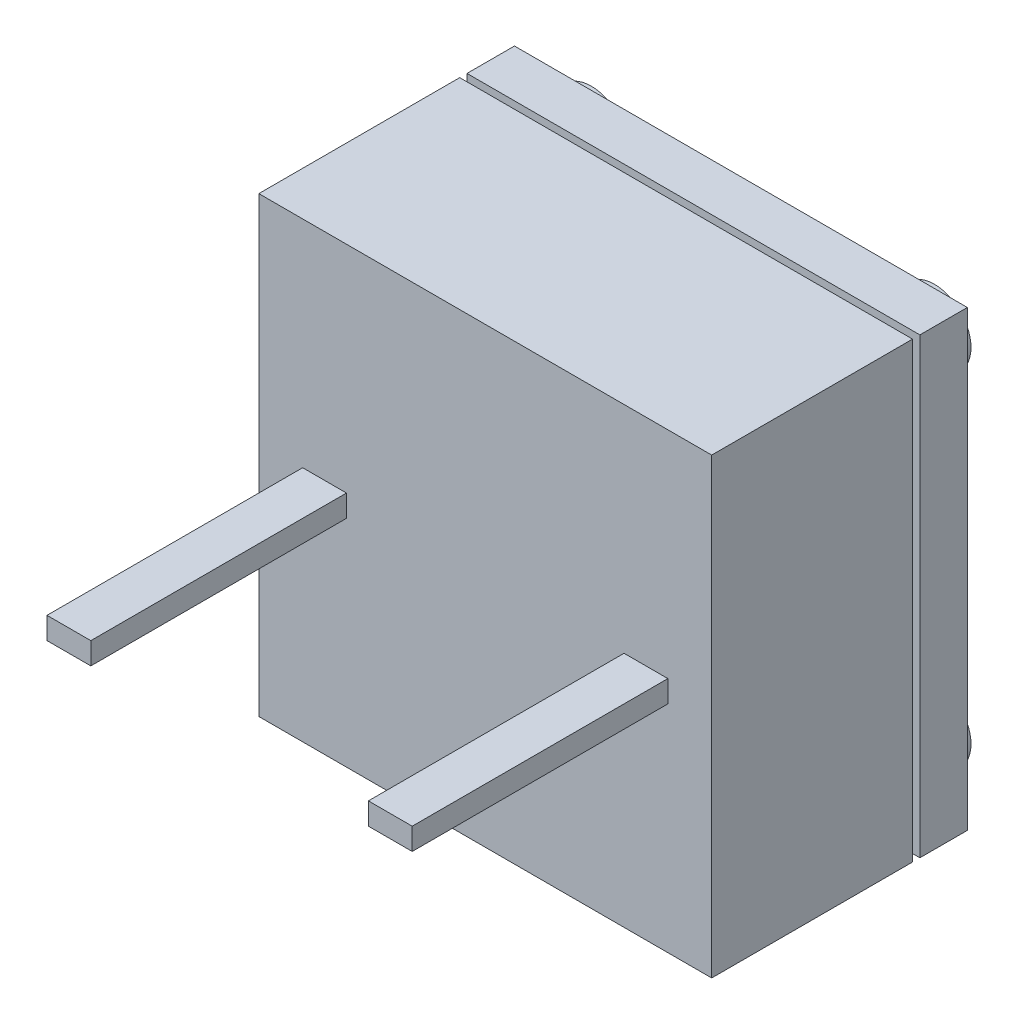
from build123d import *

# Parameters (mm, degrees)
CROQUIS1_W                 = 6.2
CROQUIS1_H                 = 6.2
SALIENTE_EXTRUIR1_DEPTH    = 3.5
CROQUIS2_W                 = 6.2
CROQUIS2_H                 = 0.1
CORTAR_EXTRUIR1_DEPTH      = 0.1
CORTAR_EXTRUIR2_DEPTH      = 10.375499987
CORTAR_EXTRUIR2_DEPTH_BACK = 10.375499987
CROQUIS3_W                 = 0.1
CROQUIS3_H                 = 0.1
CORTAR_EXTRUIR3_DEPTH      = 10.375499987
CORTAR_EXTRUIR3_DEPTH_BACK = 10.375499987
CROQUIS4_W                 = 0.1
CROQUIS4_H                 = 0.1
CROQUIS5_R                 = 1.75
SALIENTE_EXTRUIR2_DEPTH    = 1
CROQUIS6_R                 = 0.5
SALIENTE_EXTRUIR3_DEPTH    = 0.3
SALIENTE_EXTRUIR4_DEPTH    = 3.5


with BuildPart() as part:
    # Croquis1 → Saliente-Extruir1 (new body)
    with BuildSketch(Plane.XY):
        with Locations((3.1, 3.1)):
            Rectangle(CROQUIS1_W, CROQUIS1_H)
    extrude(amount=SALIENTE_EXTRUIR1_DEPTH)

    # Croquis2 → Cortar-Extruir1 (cut)
    with BuildSketch(Plane(origin=(0, 6.2, 0), x_dir=(1, 0, 0), z_dir=(0, 1, 0))):
        with Locations((3.1, -0.7)):
            Rectangle(CROQUIS2_W, CROQUIS2_H)
    extrude(amount=-CORTAR_EXTRUIR1_DEPTH, mode=Mode.SUBTRACT)

    # Croquis3 → Cortar-Extruir2 (cut, two sides: drawn at the far end of the back side and taken through both)
    with BuildSketch(Plane(origin=(0, 6.1, 0), x_dir=(1, 0, 0), z_dir=(0, 1, 0)).offset(-CORTAR_EXTRUIR2_DEPTH_BACK)):
        with Locations((0.05, -0.7)):
            Rectangle(CROQUIS3_W, CROQUIS3_H)
        with Locations((6.15, -0.7)):
            Rectangle(CROQUIS3_W, CROQUIS3_H)
    extrude(amount=CORTAR_EXTRUIR2_DEPTH + CORTAR_EXTRUIR2_DEPTH_BACK, mode=Mode.SUBTRACT)

    # Croquis4 → Cortar-Extruir3 (cut, two sides: drawn at the far end of the back side and taken through both)
    with BuildSketch(Plane.ZY.offset(-0.1).offset(-CORTAR_EXTRUIR3_DEPTH_BACK)):
        with Locations((0.7, 0.05)):
            Rectangle(CROQUIS4_W, CROQUIS4_H)
    extrude(amount=CORTAR_EXTRUIR3_DEPTH + CORTAR_EXTRUIR3_DEPTH_BACK, mode=Mode.SUBTRACT)

    # Croquis5 → Saliente-Extruir2 (add)
    with BuildSketch(Plane(origin=(0, 0, 0), x_dir=(-1, 0, 0), z_dir=(0, 0, -1))):
        with Locations((-3.1, 3.1)):
            Circle(CROQUIS5_R)
    extrude(amount=SALIENTE_EXTRUIR2_DEPTH)

    # Croquis6 → Saliente-Extruir3 (add)
    with BuildSketch(Plane(origin=(0, 0, 0), x_dir=(-1, 0, 0), z_dir=(0, 0, -1))):
        with Locations(Location((-0.75, 0.75, 0), (0, 0, 180))):
            Circle(CROQUIS6_R)
        with Locations(Location((-5.45, 0.75, 0), (0, 0, 180))):
            Circle(CROQUIS6_R)
        with Locations(Location((-0.75, 5.45, 0), (0, 0, 180))):
            Circle(CROQUIS6_R)
        with Locations(Location((-5.45, 5.45, 0), (0, 0, 180))):
            Circle(CROQUIS6_R)
    extrude(amount=SALIENTE_EXTRUIR3_DEPTH)

    # Croquis8 → Saliente-Extruir4 (add)
    with BuildSketch(Plane.XY.offset(3.5)):
        Polygon((5.6, 2.95), (5.6, 3.1), (5.6, 3.25), (5, 3.25), (5, 2.95), align=None)
        Polygon((0.6, 2.95), (0.6, 3.1), (0.6, 3.25), (1.2, 3.25), (1.2, 2.95), align=None)
    extrude(amount=SALIENTE_EXTRUIR4_DEPTH)


solid = part.part
